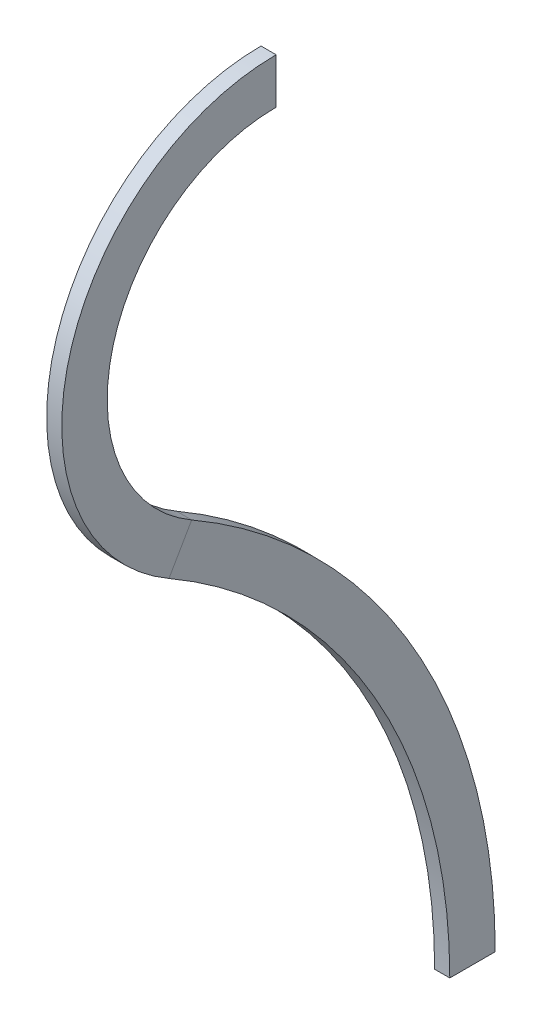
from build123d import *

# Parameters (mm, degrees)
SKETCH2_W = 2
SKETCH2_H = 6


with BuildPart() as part:
    # Sweep1: sweep along a path in Sketch1
    with BuildLine(Plane(origin=(0, 0, 0), x_dir=(0, 0, -1), z_dir=(1, 0, 0))) as sweep1_path:
        ThreePointArc((0, 117), (-27.281180678, 96.066413802), (-14.121778265, 64.296806022))
        ThreePointArc((-14.121778265, 64.296806022), (13.053249492, 37.121778265), (23, 0))
    # Sketch2 → Sweep1 (sweep)
    with BuildSketch(Plane(origin=(0, 0, 0), x_dir=(1, 0, 0), z_dir=(0, 1, 0))):
        with Locations((1, 25.934217786)):
            Rectangle(SKETCH2_W, SKETCH2_H)
    sweep(path=sweep1_path.line)


solid = part.part
